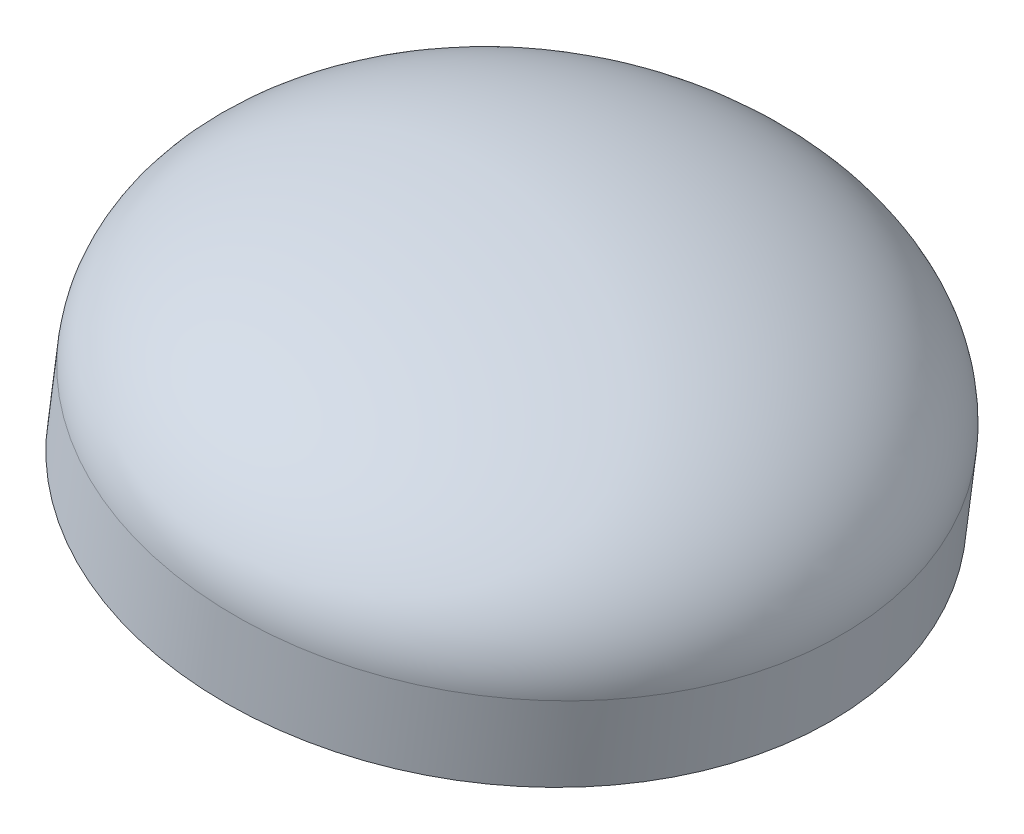
from build123d import *

# Parameters (mm, degrees)
SHELL_1_T = 2


with BuildPart() as part:
    # Эскиз1 → Повернуть1 (revolve)
    with BuildSketch(Plane.XY):
        with BuildLine():
            Line((-227.930521212, -25.457182187), (-7.417752498, -55.128192179))
            Line((-7.417752498, -55.128192179), (0, 0))
            Line((0, 0), (14.835504996, 110.256384357))
            add(Edge.make_bspline(
                [(14.835504996, 110.256384357), (-205.677263719, 139.927394349), (-220.512768714, 29.671009991)],
                knots=[4.71238898, 4.71238898, 4.71238898, 6.283185307, 6.283185307, 6.283185307], degree=2, weights=[1, 0.707106781, 1]))
            Line((-220.512768714, 29.671009991), (-227.930521212, -25.457182187))
        make_face()
    revolve(axis=Axis((14.835504996, 110.256384357, 0), (-0.13335285389374607, -0.9910686234355285, 0)))

    # Оболочка1
    shell_1_openings = [part.faces().sort_by_distance(p)[0] for p in [
        (-7.417752498, -55.128192179, 0),
    ]]
    offset(amount=SHELL_1_T, openings=shell_1_openings, kind=Kind.INTERSECTION)


solid = part.part
